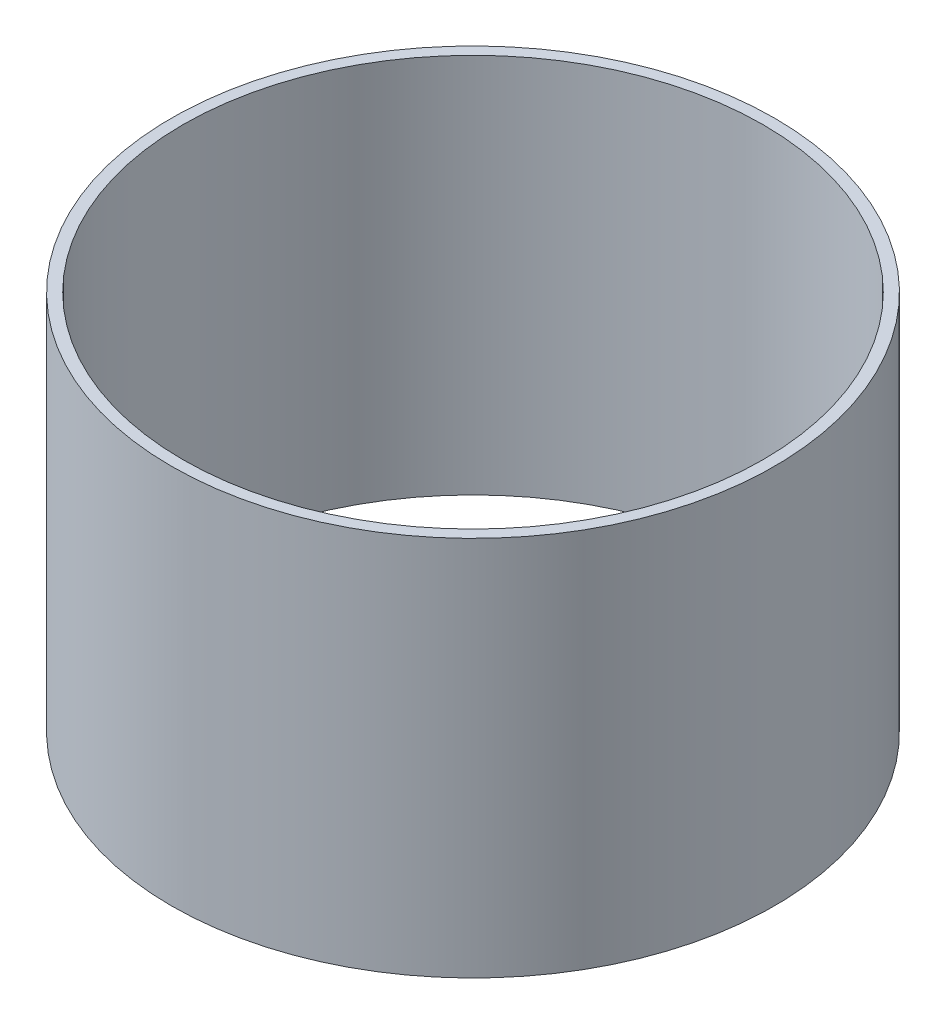
from build123d import *

# Parameters (mm, degrees)
SKETCH1_R           = 39.6
SKETCH1_R_2         = 38.1
BOSS_EXTRUDE1_DEPTH = 50


with BuildPart() as part:
    # Sketch1 → Boss-Extrude1 (new body)
    with BuildSketch(Plane(origin=(0, 0, 0), x_dir=(1, 0, 0), z_dir=(0, 1, 0))):
        with Locations(Location((0, 0, 0), (0, 0, 270))):
            Circle(SKETCH1_R)
        with Locations(Location((0, 0, 0), (0, 0, 270))):
            Circle(SKETCH1_R_2, mode=Mode.SUBTRACT)
    extrude(amount=BOSS_EXTRUDE1_DEPTH)


solid = part.part
